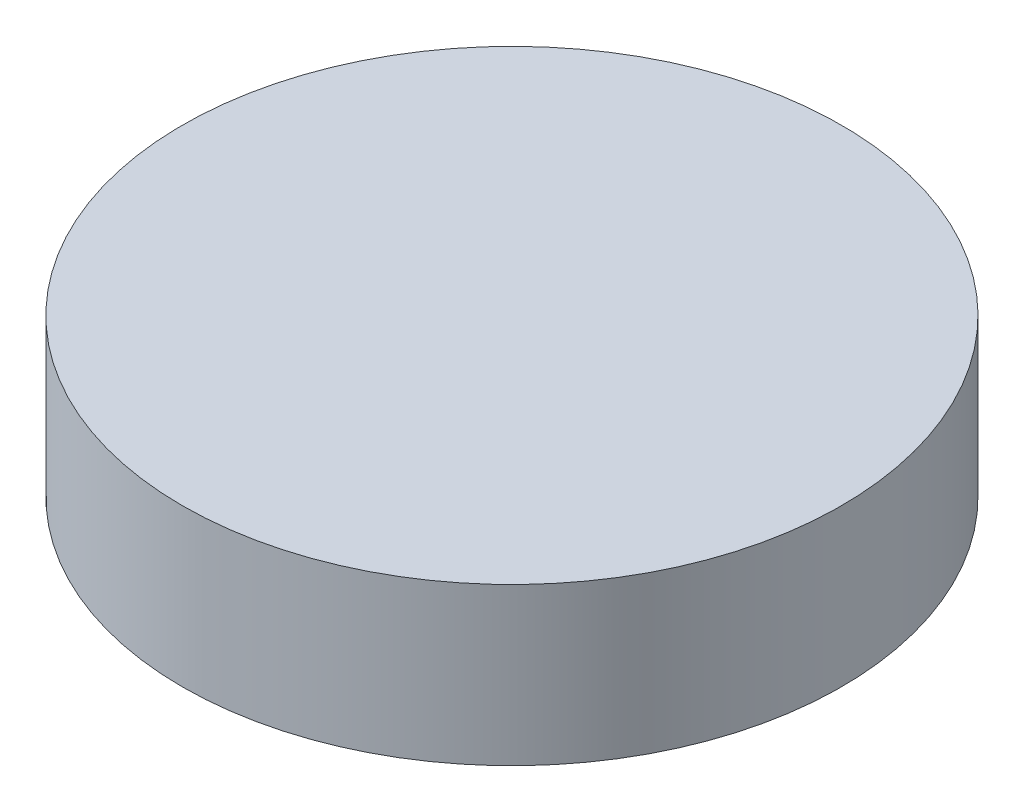
from build123d import *

# Parameters (mm, degrees)
SKETCH_1_R      = 10.5
EXTRUDE_1_DEPTH = 5


with BuildPart() as part:
    # 草圖1 → 填料-伸長1 (new body)
    with BuildSketch(Plane(origin=(0, 0, 0), x_dir=(1, 0, 0), z_dir=(0, 1, 0))):
        with Locations(Location((0, 0, 0), (0, 0, 270))):
            Circle(SKETCH_1_R)
    extrude(amount=EXTRUDE_1_DEPTH)


solid = part.part
